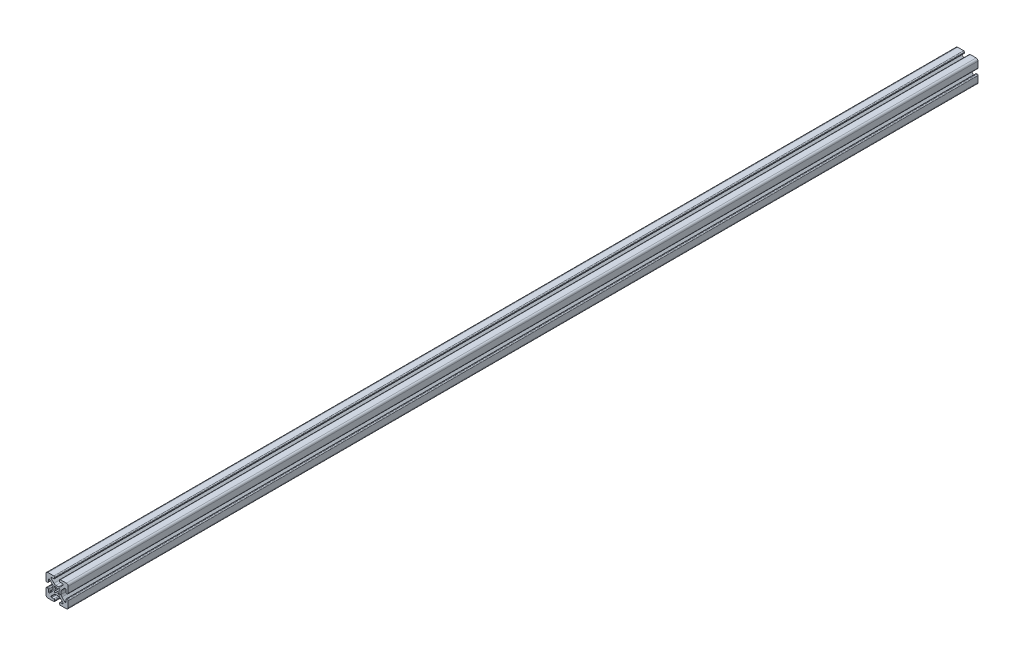
from build123d import *

# Parameters (mm, degrees)
EXTRUDE1_DEPTH = 1562.1


with BuildPart() as part:
    # Sketch1 → Extrude1 (new body)
    with BuildSketch(Plane.XY):
        with BuildLine():
            Line((14.986, -5.6388), (14.986, -9.398))
            ThreePointArc((14.986, -9.398), (14.725617928, -10.026617928), (14.097, -10.287))
            Line((14.097, -10.287), (13.528917816, -10.287))
            ThreePointArc((13.528917816, -10.287), (13.188712244, -10.219328904), (12.900299887, -10.026617928))
            Line((12.900299887, -10.026617928), (8.260840349, -5.38715839))
            ThreePointArc((8.260840349, -5.38715839), (7.231213135, -3.846212368), (6.869656138, -2.028542601))
            Line((6.869656138, -2.028542601), (6.869656138, 2.028542601))
            ThreePointArc((6.869656138, 2.028542601), (7.231213135, 3.846212368), (8.260840349, 5.38715839))
            Line((8.260840349, 5.38715839), (12.900299887, 10.026617929))
            ThreePointArc((12.900299887, 10.026617929), (13.188712244, 10.219328904), (13.528917816, 10.287))
            Line((13.528917816, 10.287), (14.097, 10.287))
            ThreePointArc((14.097, 10.287), (14.725617928, 10.026617929), (14.986, 9.398))
            Line((14.986, 9.398), (14.986, 5.6388))
            ThreePointArc((14.986, 5.6388), (15.447248241, 4.525248241), (16.5608, 4.064))
            Line((16.5608, 4.064), (17.4752, 4.064))
            ThreePointArc((17.4752, 4.064), (18.588751759, 4.525248241), (19.05, 5.6388))
            Line((19.05, 5.6388), (19.05, 15.875))
            ThreePointArc((19.05, 15.875), (18.12006403, 18.12006403), (15.875, 19.05))
            Line((15.875, 19.05), (5.6388, 19.05))
            ThreePointArc((5.6388, 19.05), (4.525248241, 18.588751759), (4.064, 17.4752))
            Line((4.064, 17.4752), (4.064, 16.5608))
            ThreePointArc((4.064, 16.5608), (4.525248241, 15.447248241), (5.6388, 14.986))
            Line((5.6388, 14.986), (9.398, 14.986))
            ThreePointArc((9.398, 14.986), (10.026617928, 14.725617928), (10.287, 14.097))
            Line((10.287, 14.097), (10.287, 13.528917816))
            ThreePointArc((10.287, 13.528917816), (10.219328904, 13.188712244), (10.026617928, 12.900299887))
            Line((10.026617928, 12.900299887), (5.38715839, 8.260840349))
            ThreePointArc((5.38715839, 8.260840349), (3.846212368, 7.231213135), (2.028542601, 6.869656138))
            Line((2.028542601, 6.869656138), (-2.028542601, 6.869656138))
            ThreePointArc((-2.028542601, 6.869656138), (-3.846212368, 7.231213135), (-5.38715839, 8.260840349))
            Line((-5.38715839, 8.260840349), (-10.026617929, 12.900299887))
            ThreePointArc((-10.026617929, 12.900299887), (-10.219328904, 13.188712244), (-10.287, 13.528917816))
            Line((-10.287, 13.528917816), (-10.287, 14.097))
            ThreePointArc((-10.287, 14.097), (-10.026617929, 14.725617928), (-9.398, 14.986))
            Line((-9.398, 14.986), (-5.6388, 14.986))
            ThreePointArc((-5.6388, 14.986), (-4.525248241, 15.447248241), (-4.064, 16.5608))
            Line((-4.064, 16.5608), (-4.064, 17.4752))
            ThreePointArc((-4.064, 17.4752), (-4.525248241, 18.588751759), (-5.6388, 19.05))
            Line((-5.6388, 19.05), (-15.875, 19.05))
            ThreePointArc((-15.875, 19.05), (-18.12006403, 18.12006403), (-19.05, 15.875))
            Line((-19.05, 15.875), (-19.05, 5.6388))
            ThreePointArc((-19.05, 5.6388), (-18.588751759, 4.525248241), (-17.4752, 4.064))
            Line((-17.4752, 4.064), (-16.5608, 4.064))
            ThreePointArc((-16.5608, 4.064), (-15.447248241, 4.525248241), (-14.986, 5.6388))
            Line((-14.986, 5.6388), (-14.986, 9.398))
            ThreePointArc((-14.986, 9.398), (-14.725617929, 10.026617928), (-14.097, 10.287))
            Line((-14.097, 10.287), (-13.528917816, 10.287))
            ThreePointArc((-13.528917816, 10.287), (-13.188712244, 10.219328904), (-12.900299887, 10.026617928))
            Line((-12.900299887, 10.026617928), (-8.260840349, 5.38715839))
            ThreePointArc((-8.260840349, 5.38715839), (-7.231213135, 3.846212368), (-6.869656138, 2.028542601))
            Line((-6.869656138, 2.028542601), (-6.869656138, -2.028542601))
            ThreePointArc((-6.869656138, -2.028542601), (-7.231213135, -3.846212368), (-8.260840349, -5.38715839))
            Line((-8.260840349, -5.38715839), (-12.900299887, -10.026617928))
            ThreePointArc((-12.900299887, -10.026617928), (-13.188712244, -10.219328904), (-13.528917816, -10.287))
            Line((-13.528917816, -10.287), (-14.097, -10.287))
            ThreePointArc((-14.097, -10.287), (-14.725617928, -10.026617928), (-14.986, -9.398))
            Line((-14.986, -9.398), (-14.986, -5.6388))
            ThreePointArc((-14.986, -5.6388), (-15.447248241, -4.525248241), (-16.5608, -4.064))
            Line((-16.5608, -4.064), (-17.4752, -4.064))
            ThreePointArc((-17.4752, -4.064), (-18.588751759, -4.525248241), (-19.05, -5.6388))
            Line((-19.05, -5.6388), (-19.05, -15.875))
            ThreePointArc((-19.05, -15.875), (-18.12006403, -18.12006403), (-15.875, -19.05))
            Line((-15.875, -19.05), (-5.6388, -19.05))
            ThreePointArc((-5.6388, -19.05), (-4.525248241, -18.588751759), (-4.064, -17.4752))
            Line((-4.064, -17.4752), (-4.064, -16.5608))
            ThreePointArc((-4.064, -16.5608), (-4.525248241, -15.447248241), (-5.6388, -14.986))
            Line((-5.6388, -14.986), (-9.398, -14.986))
            ThreePointArc((-9.398, -14.986), (-10.026617928, -14.725617928), (-10.287, -14.097))
            Line((-10.287, -14.097), (-10.287, -13.528917816))
            ThreePointArc((-10.287, -13.528917816), (-10.219328904, -13.188712244), (-10.026617928, -12.900299887))
            Line((-10.026617928, -12.900299887), (-5.38715839, -8.260840349))
            ThreePointArc((-5.38715839, -8.260840349), (-3.846212368, -7.231213135), (-2.028542601, -6.869656138))
            Line((-2.028542601, -6.869656138), (2.028542601, -6.869656138))
            ThreePointArc((2.028542601, -6.869656138), (3.846212368, -7.231213135), (5.38715839, -8.260840349))
            Line((5.38715839, -8.260840349), (10.026617928, -12.900299887))
            ThreePointArc((10.026617928, -12.900299887), (10.219328904, -13.188712244), (10.287, -13.528917816))
            Line((10.287, -13.528917816), (10.287, -14.097))
            ThreePointArc((10.287, -14.097), (10.026617928, -14.725617928), (9.398, -14.986))
            Line((9.398, -14.986), (5.6388, -14.986))
            ThreePointArc((5.6388, -14.986), (4.525248241, -15.447248241), (4.064, -16.5608))
            Line((4.064, -16.5608), (4.064, -17.4752))
            ThreePointArc((4.064, -17.4752), (4.525248241, -18.588751759), (5.6388, -19.05))
            Line((5.6388, -19.05), (15.875, -19.05))
            ThreePointArc((15.875, -19.05), (18.12006403, -18.12006403), (19.05, -15.875))
            Line((19.05, -15.875), (19.05, -5.6388))
            ThreePointArc((19.05, -5.6388), (18.588751759, -4.525248241), (17.4752, -4.064))
            Line((17.4752, -4.064), (16.5608, -4.064))
            ThreePointArc((16.5608, -4.064), (15.447248241, -4.525248241), (14.986, -5.6388))
        make_face()
        with BuildLine():
            Line((4.24561082, 2.639761197), (3.01775857, 1.401686117))
            ThreePointArc((3.01775857, 1.401686117), (3.327399997, 0.000140662), (3.017877069, -1.401430967))
            Line((3.017877069, -1.401430967), (4.343300873, -2.726854771))
            ThreePointArc((4.343300873, -2.726854771), (4.343300873, -4.343300873), (2.726854771, -4.343300873))
            Line((2.726854771, -4.343300873), (1.401430967, -3.017877069))
            ThreePointArc((1.401430967, -3.017877069), (0, -3.3274), (-1.401430967, -3.017877069))
            Line((-1.401430967, -3.017877069), (-2.726854771, -4.343300873))
            ThreePointArc((-2.726854771, -4.343300873), (-4.343300873, -4.343300873), (-4.343300873, -2.726854771))
            Line((-4.343300873, -2.726854771), (-3.017877069, -1.401430967))
            ThreePointArc((-3.017877069, -1.401430967), (-3.3274, 0), (-3.017877069, 1.401430967))
            Line((-3.017877069, 1.401430967), (-4.343300873, 2.726854771))
            ThreePointArc((-4.343300873, 2.726854771), (-4.343300873, 4.343300873), (-2.726854771, 4.343300873))
            Line((-2.726854771, 4.343300873), (-1.401430967, 3.017877069))
            ThreePointArc((-1.401430967, 3.017877069), (0.000140662, 3.327399997), (1.401686117, 3.01775857))
            Line((1.401686117, 3.01775857), (2.639761197, 4.24561082))
            ThreePointArc((2.639761197, 4.24561082), (4.343300873, 4.343300873), (4.24561082, 2.639761197))
        make_face(mode=Mode.SUBTRACT)
    extrude(amount=-EXTRUDE1_DEPTH)


solid = part.part
